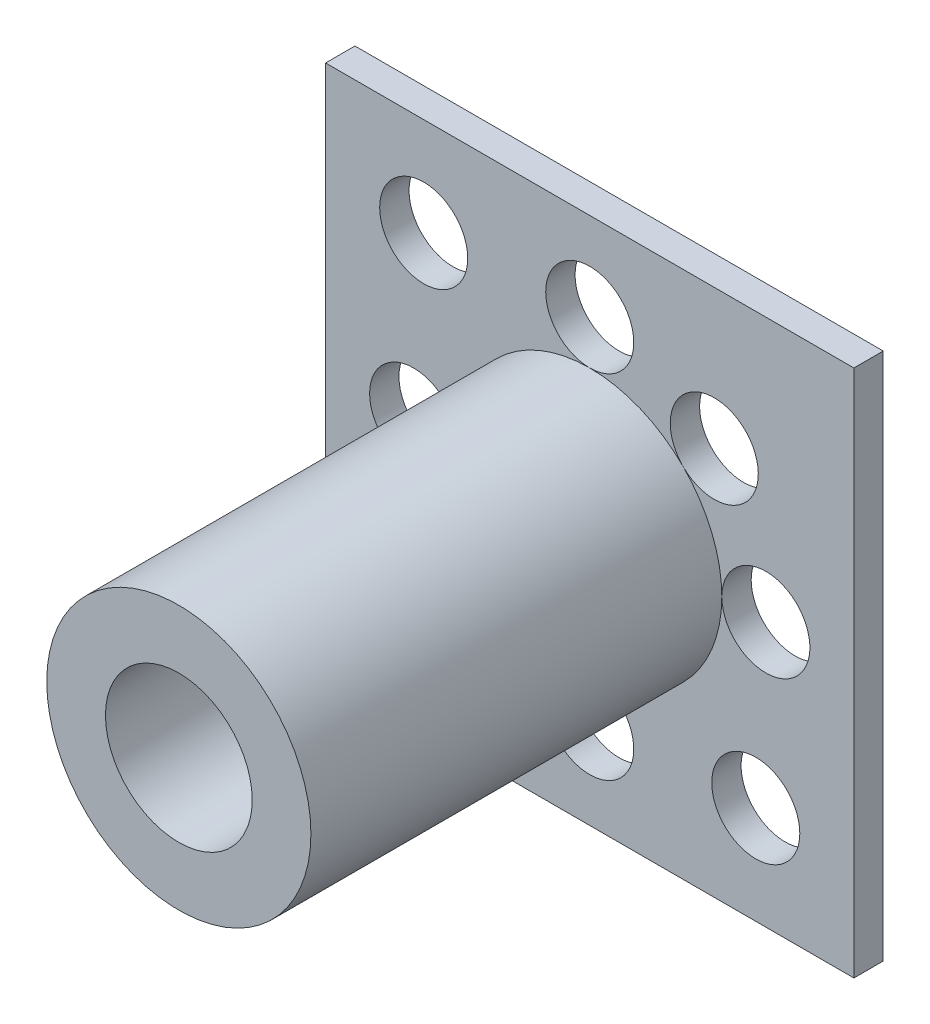
from build123d import *
from build123d.topology import SkipClean

# Parameters (mm, degrees)
SKETCH1_R           = 4.5
SKETCH1_R_2         = 2.5
BOSS_EXTRUDE1_DEPTH = 15
SKETCH2_W           = 18
SKETCH2_H           = 18
BOSS_EXTRUDE2_DEPTH = 1
SKETCH3_R           = 1.5
SKETCH3_R_2         = 2.5
CUT_EXTRUDE1_DEPTH  = 2


with BuildPart() as part:
    # Sketch1 → Boss-Extrude1 (new body)
    with BuildSketch(Plane.XY):
        Circle(SKETCH1_R)
        Circle(SKETCH1_R_2, mode=Mode.SUBTRACT)
    extrude(amount=BOSS_EXTRUDE1_DEPTH)

    # Sketch2 → Boss-Extrude2 (add)
    with BuildSketch(Plane.XY):
        Rectangle(SKETCH2_W, SKETCH2_H)
    extrude(amount=BOSS_EXTRUDE2_DEPTH)

    # Sketch3 → Cut-Extrude1 (cut)
    with SkipClean():  # the faces are left unmerged after this step: merging them gives an invalid solid
        with BuildSketch(Plane(origin=(0, 0, 0), x_dir=(-1, 0, 0), z_dir=(0, 0, -1))):
            with Locations((5.656854249, 5.656854249)):
                Circle(SKETCH3_R)
            with Locations(Location((-5.656854249, -5.656854249, 0), (0, 0, 180))):
                Circle(SKETCH3_R)
            with Locations((-4.242640687, 4.242640687)):
                Circle(SKETCH3_R)
            with Locations(Location((4.242640687, -4.242640687, 0), (0, 0, 134.999427021))):
                Circle(SKETCH3_R)
            with Locations((0, 6)):
                Circle(SKETCH3_R)
            with Locations((6, 0)):
                Circle(SKETCH3_R)
            with Locations((0, -6)):
                Circle(SKETCH3_R)
            with Locations((-6, 0)):
                Circle(SKETCH3_R)
            Circle(SKETCH3_R_2)
        extrude(amount=-CUT_EXTRUDE1_DEPTH, mode=Mode.SUBTRACT)


solid = part.part
